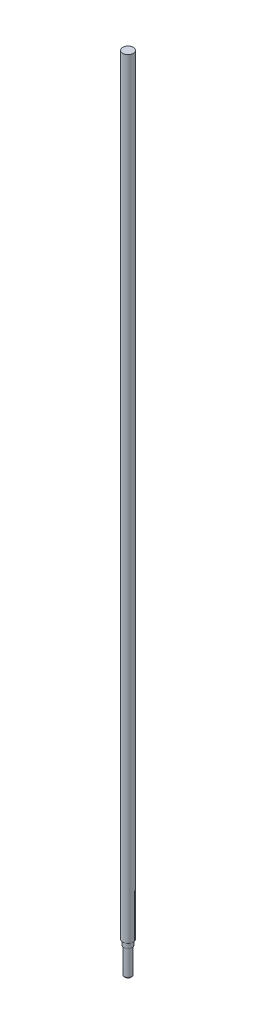
from build123d import *

# Parameters (mm, degrees)
SKETCH_1_R          = 50
EXTRUDE_1_DEPTH     = 7600
SKETCH_3_R          = 50
SKETCH_3_R_2        = 40
CUT_EXTRUDE_1_DEPTH = 7301.342457721
SKETCH_4_R          = 40
SKETCH_4_R_2        = 35
CUT_EXTRUDE_2_DEPTH = 7351.340128185
FILLET_1_R          = 10


with BuildPart() as part:
    # ｽｹｯﾁ1 → ﾎﾞｽ - 押し出し1 (new body)
    with BuildSketch(Plane(origin=(0, 0, 0), x_dir=(1, 0, 0), z_dir=(0, 1, 0))):
        Circle(SKETCH_1_R)
    extrude(amount=EXTRUDE_1_DEPTH)

    # ｽｹｯﾁ3 → ｶｯﾄ - 押し出し1 (cut, through all)
    with BuildSketch(Plane(origin=(0, 300, 0), x_dir=(1, 0, 0), z_dir=(0, 1, 0))):
        Circle(SKETCH_3_R)
        Circle(SKETCH_3_R_2, mode=Mode.SUBTRACT)
    extrude(amount=-CUT_EXTRUDE_1_DEPTH, mode=Mode.SUBTRACT)

    # ｽｹｯﾁ4 → ｶｯﾄ - 押し出し2 (cut, through all)
    with BuildSketch(Plane(origin=(0, 250, 0), x_dir=(1, 0, 0), z_dir=(0, 1, 0))):
        Circle(SKETCH_4_R)
        Circle(SKETCH_4_R_2, mode=Mode.SUBTRACT)
    extrude(amount=-CUT_EXTRUDE_2_DEPTH, mode=Mode.SUBTRACT)

    # ﾌｨﾚｯﾄ1
    fillet_1_edges = [part.edges().sort_by_distance(p)[0] for p in [
        (-35, 0, 0),
    ]]
    fillet(fillet_1_edges, radius=FILLET_1_R)


solid = part.part
